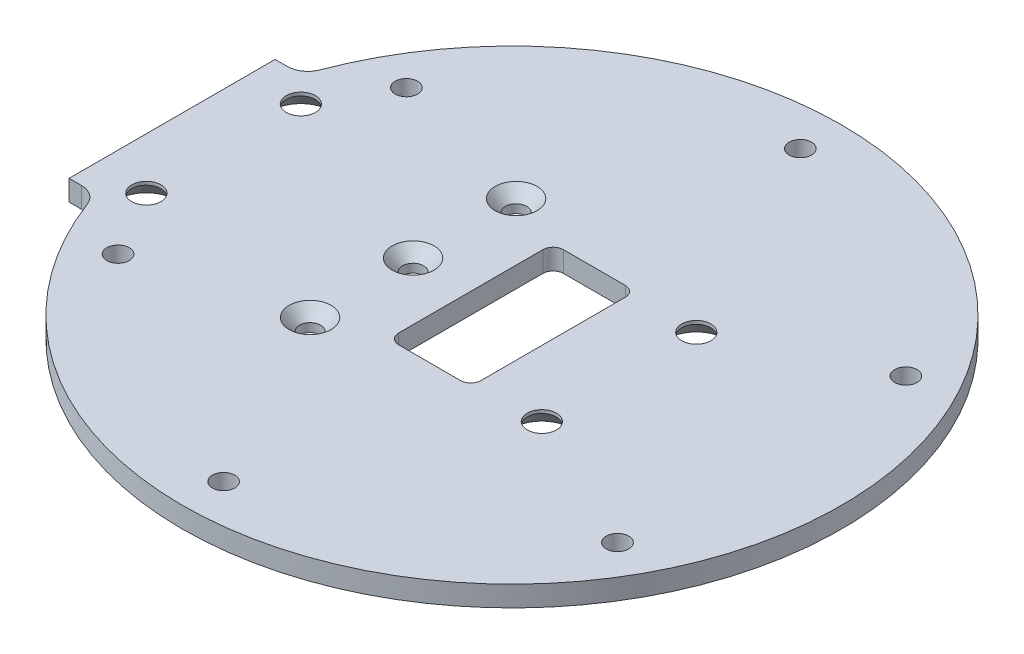
from build123d import *

# Parameters (mm, degrees)
SKETCH1_R                                     = 50.8
BOSS_EXTRUDE1_DEPTH                           = 3.175
BOSS_EXTRUDE2_DEPTH                           = 3.175
FILLET1_R                                     = 3.175
CSK_FOR_8_FLAT_HEAD_SOCKET_CAP_SCREW1_A_COUNT = 2
CSK_FOR_8_FLAT_HEAD_SOCKET_CAP_SCREW1_A_PITCH = 23.8125
CSK_FOR_8_FLAT_HEAD_SOCKET_CAP_SCRE_2_COUNT   = 2
CSK_FOR_8_FLAT_HEAD_SOCKET_CAP_SCRE_2_PITCH   = 65.445830702
CSK_FOR_8_FLAT_HEAD_SOCKET_CAP_SCRE_3_COUNT   = 2
CSK_FOR_8_FLAT_HEAD_SOCKET_CAP_SCRE_3_PITCH   = 60.96
CIRPATTERN1_COUNT                             = 6
CSK_FOR_4_FLAT_HEAD_SOCKET_CAP_SCREW2_A_COUNT = 2
CSK_FOR_4_FLAT_HEAD_SOCKET_CAP_SCREW2_A_PITCH = 15.875
CSK_FOR_4_FLAT_HEAD_SOCKET_CAP_SCRE_2_COUNT   = 2
CSK_FOR_4_FLAT_HEAD_SOCKET_CAP_SCRE_2_PITCH   = 15.875
SKETCH17_W                                    = 12.7
SKETCH17_H                                    = 25.4
CUT_EXTRUDE2_DEPTH                            = 74.042253397
FILLET2_R                                     = 1.5875


with BuildPart() as part:
    # Sketch1 → Boss-Extrude1 (new body)
    with BuildSketch(Plane(origin=(0, 0, 0), x_dir=(1, 0, 0), z_dir=(0, 1, 0))):
        with Locations(Location((0, 0, 0), (0, 0, 270))):
            Circle(SKETCH1_R)
    extrude(amount=BOSS_EXTRUDE1_DEPTH)

    # Sketch8 → Boss-Extrude2 (add)
    with BuildSketch(Plane.XZ):
        with BuildLine():
            Line((-52.3875, -15.875), (-48.255822188, -15.875))
            ThreePointArc((-48.255822188, -15.875), (-50.8, 0), (-48.255822188, 15.875))
            Line((-48.255822188, 15.875), (-52.3875, 15.875))
            Line((-52.3875, 15.875), (-52.3875, -15.875))
        make_face()
    extrude(amount=-BOSS_EXTRUDE2_DEPTH)

    # Fillet1
    fillet1_edges = [part.edges().sort_by_distance(p)[0] for p in [
        (-48.255822188, 1.5875, 15.875),
        (-48.255822188, 1.5875, -15.875),
    ]]
    fillet(fillet1_edges, radius=FILLET1_R)

    # Sketch6 → CSK for #8 Flat Head Socket Cap Screw1 (revolve, cut)
    with BuildSketch(Plane(origin=(-44.45, 0, 11.90625), x_dir=(0, 0, -1), z_dir=(1, 0, 0))):
        Polygon((0, 0), (0, 3.175), (2.2479, 3.175), (2.2479, 2.658961536), (4.5593, 0), align=None)
    csk_for_8_flat_head_socket_cap_screw1 = revolve(axis=Axis((-44.45, -6.35, 11.90625), (0, 1, 0)), mode=Mode.SUBTRACT)

    # CSK for #8 Flat Head Socket Cap Screw1 a: CSK for #8 Flat Head Socket Cap Screw1 ×2
    with Locations(*[(0, 0, -i * CSK_FOR_8_FLAT_HEAD_SOCKET_CAP_SCREW1_A_PITCH) for i in range(1, CSK_FOR_8_FLAT_HEAD_SOCKET_CAP_SCREW1_A_COUNT)]):
        add(csk_for_8_flat_head_socket_cap_screw1, mode=Mode.SUBTRACT)

    # CSK for _8 Flat Head Socket Cap Scre 2: CSK for #8 Flat Head Socket Cap Screw1 ×2
    with Locations(*[Vector(0.9314573494796193, 0, -0.36385052714047633) * (i * CSK_FOR_8_FLAT_HEAD_SOCKET_CAP_SCRE_2_PITCH) for i in range(1, CSK_FOR_8_FLAT_HEAD_SOCKET_CAP_SCRE_2_COUNT)]):
        add(csk_for_8_flat_head_socket_cap_screw1, mode=Mode.SUBTRACT)

    # CSK for _8 Flat Head Socket Cap Scre 3: CSK for #8 Flat Head Socket Cap Screw1 ×2
    with Locations(*[(i * CSK_FOR_8_FLAT_HEAD_SOCKET_CAP_SCRE_3_PITCH, 0, 0) for i in range(1, CSK_FOR_8_FLAT_HEAD_SOCKET_CAP_SCRE_3_COUNT)]):
        add(csk_for_8_flat_head_socket_cap_screw1, mode=Mode.SUBTRACT)

    # Sketch10 → #8-32 Tapped Hole1 (revolve, cut)
    with BuildSketch(Plane(origin=(0, 3.175, -44.45), x_dir=(0, 0, 1), z_dir=(1, 0, 0))):
        Polygon((0, 0), (0, 11.705806461), (1.7272, 10.668), (1.7272, 0), align=None)
    f_8_32_tapped_hole1 = revolve(axis=Axis((0, 9.525, -44.45), (0, -1, 0)), mode=Mode.SUBTRACT)

    # CirPattern1: #8-32 Tapped Hole1 ×6 about axis
    cirpattern1_axis = Axis((0, 0, 0), (0, 1, 0))
    for i in range(1, CIRPATTERN1_COUNT):
        add(f_8_32_tapped_hole1.rotate(cirpattern1_axis, i * 360 / CIRPATTERN1_COUNT), mode=Mode.SUBTRACT)

    # Sketch15 → CSK for #4 Flat Head Socket Cap Screw2 (revolve, cut)
    with BuildSketch(Plane(origin=(-15.24, 3.175, 0), x_dir=(0, 0, 1), z_dir=(1, 0, 0))):
        Polygon((0, 0), (0, 3.175), (1.63195, 3.175), (1.63195, 1.848124365), (3.2385, 0), align=None)
    csk_for_4_flat_head_socket_cap_screw2 = revolve(axis=Axis((-15.24, 9.525, 0), (0, -1, 0)), mode=Mode.SUBTRACT)

    # CSK for #4 Flat Head Socket Cap Screw2 a: CSK for #4 Flat Head Socket Cap Screw2 ×2
    with Locations(*[(0, 0, -i * CSK_FOR_4_FLAT_HEAD_SOCKET_CAP_SCREW2_A_PITCH) for i in range(1, CSK_FOR_4_FLAT_HEAD_SOCKET_CAP_SCREW2_A_COUNT)]):
        add(csk_for_4_flat_head_socket_cap_screw2, mode=Mode.SUBTRACT)

    # CSK for _4 Flat Head Socket Cap Scre 2: CSK for #4 Flat Head Socket Cap Screw2 ×2
    with Locations(*[(0, 0, i * CSK_FOR_4_FLAT_HEAD_SOCKET_CAP_SCRE_2_PITCH) for i in range(1, CSK_FOR_4_FLAT_HEAD_SOCKET_CAP_SCRE_2_COUNT)]):
        add(csk_for_4_flat_head_socket_cap_screw2, mode=Mode.SUBTRACT)

    # Sketch17 → Cut-Extrude2 (cut, through all)
    with BuildSketch(Plane(origin=(0, 3.175, 0), x_dir=(1, 0, 0), z_dir=(0, 1, 0))):
        Rectangle(SKETCH17_W, SKETCH17_H)
    extrude(amount=-CUT_EXTRUDE2_DEPTH, mode=Mode.SUBTRACT)

    # Fillet2
    fillet2_edges = [part.edges().sort_by_distance(p)[0] for p in [
        (-6.35, 1.5875, 12.7),
        (-6.35, 1.5875, -12.7),
        (6.35, 1.5875, -12.7),
        (6.35, 1.5875, 12.7),
    ]]
    fillet(fillet2_edges, radius=FILLET2_R)


solid = part.part
